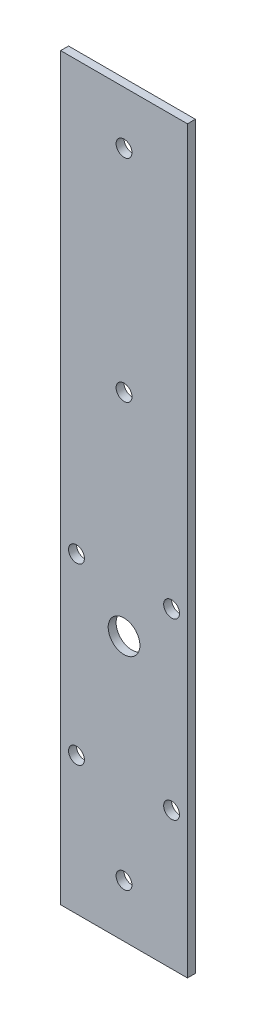
from build123d import *

# Parameters (mm, degrees)
SKETCH_1_W      = 24
SKETCH_1_H      = 140
SKETCH_1_R      = 1.5
SKETCH_1_R_2    = 3
EXTRUDE_1_DEPTH = 1.5


with BuildPart() as part:
    # 草图1 → 凸台-拉伸1 (new body)
    with BuildSketch(Plane.XY):
        Rectangle(SKETCH_1_W, SKETCH_1_H)
        with Locations((0, 20)):
            Circle(SKETCH_1_R, mode=Mode.SUBTRACT)
        with Locations((0, -60)):
            Circle(SKETCH_1_R, mode=Mode.SUBTRACT)
        with Locations(Location((0, 60, 0), (0, 0, 180))):
            Circle(SKETCH_1_R, mode=Mode.SUBTRACT)
        with Locations((-9, -11)):
            Circle(SKETCH_1_R, mode=Mode.SUBTRACT)
        with Locations((9, -11)):
            Circle(SKETCH_1_R, mode=Mode.SUBTRACT)
        with Locations((9, -44)):
            Circle(SKETCH_1_R, mode=Mode.SUBTRACT)
        with Locations((-9, -44)):
            Circle(SKETCH_1_R, mode=Mode.SUBTRACT)
        with Locations((0, -20)):
            Circle(SKETCH_1_R_2, mode=Mode.SUBTRACT)
    extrude(amount=EXTRUDE_1_DEPTH)


solid = part.part
